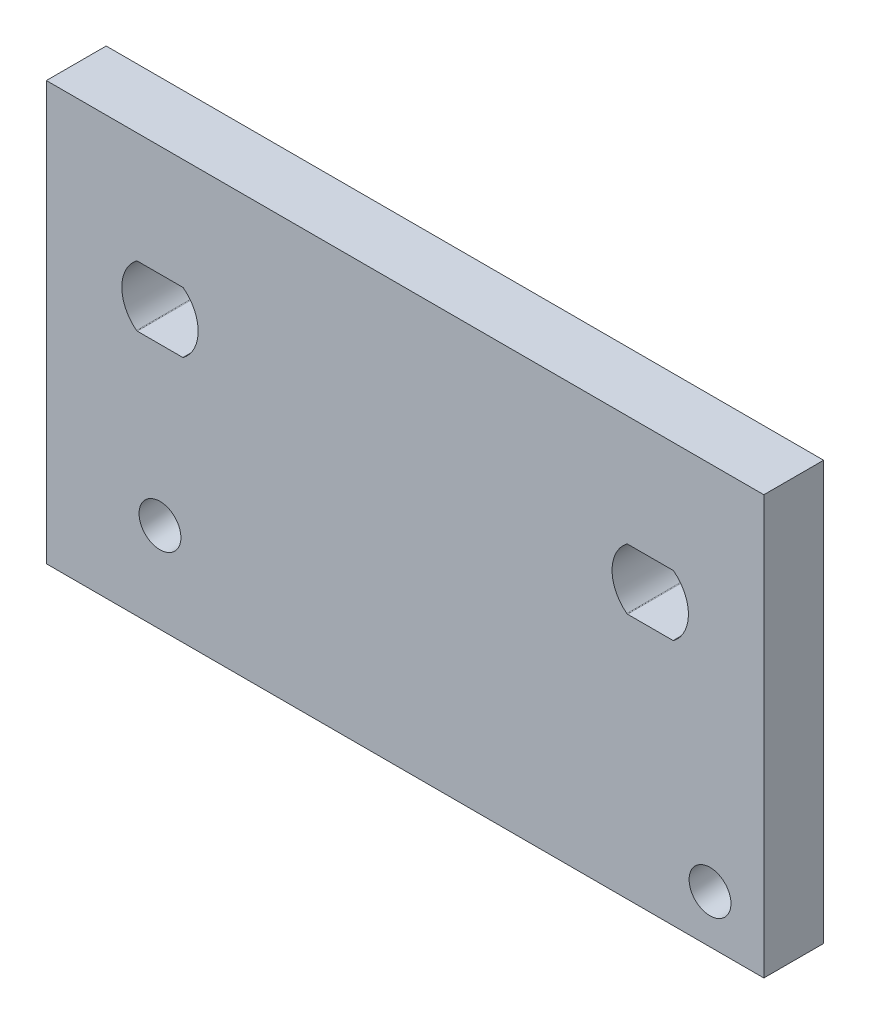
from build123d import *

# Parameters (mm, degrees)
SKETCH1_W           = 140
SKETCH1_H           = 70
BOSS_EXTRUDE1_DEPTH = 10
CUT_EXTRUDE1_DEPTH  = 79.89866919
SKETCH3_W           = 10
SKETCH3_H           = 70
CUT_EXTRUDE2_DEPTH  = 10
SKETCH4_W           = 10
SKETCH4_H           = 70
CUT_EXTRUDE3_DEPTH  = 10
SKETCH5_R           = 3.5
CUT_EXTRUDE4_DEPTH  = 71.99166851


with BuildPart() as part:
    # Sketch1 → Boss-Extrude1 (new body)
    with BuildSketch(Plane.XY):
        Rectangle(SKETCH1_W, SKETCH1_H)
    extrude(amount=BOSS_EXTRUDE1_DEPTH)

    # Sketch2 → Cut-Extrude1 (cut, through all)
    with BuildSketch(Plane(origin=(0, 0, 0), x_dir=(-1, 0, 0), z_dir=(0, 0, -1))):
        with BuildLine():
            Line((-44.799329863, 6.296119908), (-37.200670137, 6.296119908))
            ThreePointArc((-37.200670137, 6.296119908), (-37.134647488, 6.307144858), (-37.075789173, 6.339023354))
            ThreePointArc((-37.075789173, 6.339023354), (-34.614722222, 11.376119908), (-37.075789173, 16.413216461))
            ThreePointArc((-37.075789173, 16.413216461), (-37.134647488, 16.445094958), (-37.200670137, 16.456119908))
            Line((-37.200670137, 16.456119908), (-44.799329863, 16.456119908))
            ThreePointArc((-44.799329863, 16.456119908), (-44.865352512, 16.445094958), (-44.924210827, 16.413216461))
            ThreePointArc((-44.924210827, 16.413216461), (-47.385277778, 11.376119908), (-44.924210827, 6.339023354))
            ThreePointArc((-44.924210827, 6.339023354), (-44.865352512, 6.307144858), (-44.799329863, 6.296119908))
        make_face()
        with BuildLine():
            Line((37.200670137, 16.456119908), (44.799329863, 16.456119908))
            ThreePointArc((44.799329863, 16.456119908), (44.865352512, 16.445094958), (44.924210827, 16.413216461))
            ThreePointArc((44.924210827, 16.413216461), (47.385277778, 11.376119908), (44.924210827, 6.339023354))
            ThreePointArc((44.924210827, 6.339023354), (44.865352512, 6.307144858), (44.799329863, 6.296119908))
            Line((44.799329863, 6.296119908), (37.200670137, 6.296119908))
            ThreePointArc((37.200670137, 6.296119908), (37.134647488, 6.307144858), (37.075789173, 6.339023354))
            ThreePointArc((37.075789173, 6.339023354), (34.614722222, 11.376119908), (37.075789173, 16.413216461))
            ThreePointArc((37.075789173, 16.413216461), (37.134647488, 16.445094958), (37.200670137, 16.456119908))
        make_face()
    extrude(amount=-CUT_EXTRUDE1_DEPTH, mode=Mode.SUBTRACT)

    # Sketch3 → Cut-Extrude2 (cut)
    with BuildSketch(Plane(origin=(70, 0, 0), x_dir=(0, 0, -1), z_dir=(1, 0, 0))):
        with Locations((-5, 0)):
            Rectangle(SKETCH3_W, SKETCH3_H)
    extrude(amount=-CUT_EXTRUDE2_DEPTH, mode=Mode.SUBTRACT)

    # Sketch4 → Cut-Extrude3 (cut)
    with BuildSketch(Plane.ZY.offset(70)):
        with Locations((5, 0)):
            Rectangle(SKETCH4_W, SKETCH4_H)
    extrude(amount=-CUT_EXTRUDE3_DEPTH, mode=Mode.SUBTRACT)

    # Sketch5 → Cut-Extrude4 (cut, through all)
    with BuildSketch(Plane(origin=(0, -0.866174302, 12.386869611), x_dir=(1, 0, 0), z_dir=(0, -0.06975647374412544, 0.9975640502598242))):
        with Locations(Location((51, -26.217177022, 0), (0, 0, 270))):
            Circle(SKETCH5_R)
        with Locations(Location((-41, -19.217177022, 0), (0, 0, 270))):
            Circle(SKETCH5_R)
    extrude(amount=-CUT_EXTRUDE4_DEPTH, mode=Mode.SUBTRACT)


solid = part.part
